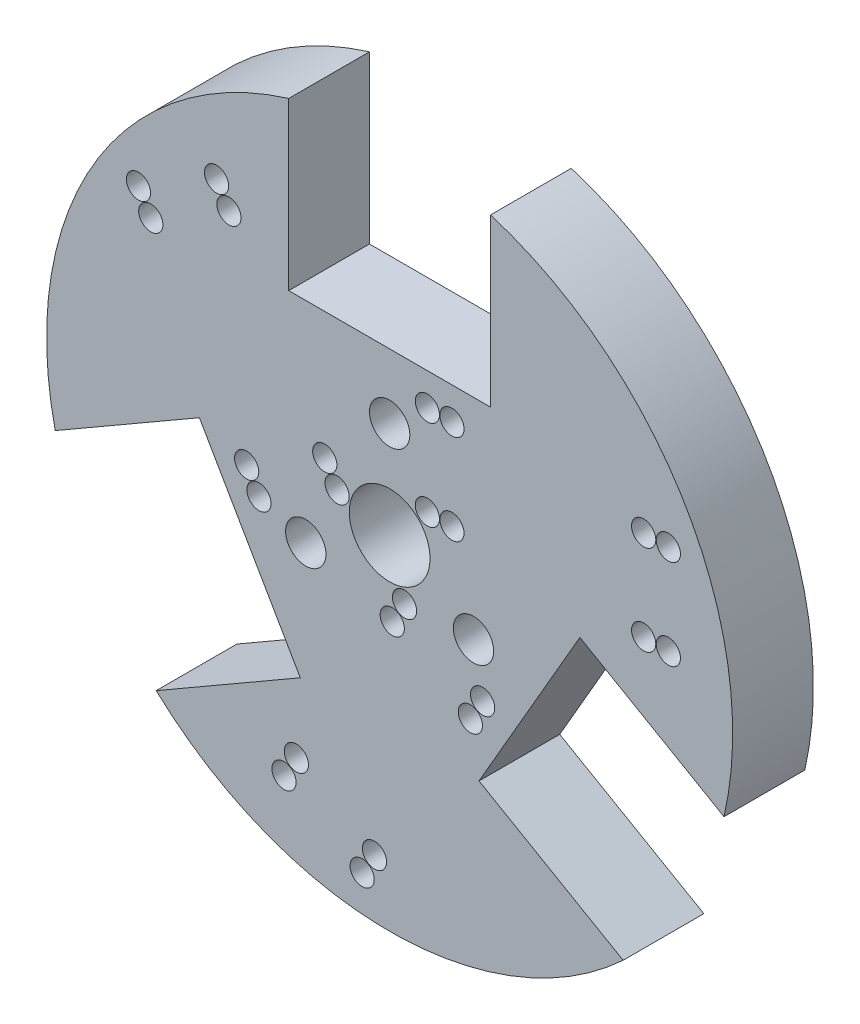
from build123d import *

# Parameters (mm, degrees)
SKETCH4_R      = 42.5
BASE_DEPTH     = 10
SKETCH5_R      = 5
SKETCH5_W      = 25
SKETCH5_H      = 40
TYRE_CUT_DEPTH = 10
SKETCH6_R      = 1.5
SKETCH6_R_2    = 2.5
NUTS_DEPTH     = 10


with BuildPart() as part:
    # Sketch4 → base (new body)
    with BuildSketch(Plane.XY):
        Circle(SKETCH4_R)
    extrude(amount=BASE_DEPTH)

    # Sketch5 → Tyre cut (cut)
    with BuildSketch(Plane.XY):
        Circle(SKETCH5_R)
        with Locations((0, 40)):
            Rectangle(SKETCH5_W, SKETCH5_H)
        Polygon((11.070508076, -20.825317547), (23.570508076, 0.825317547), (58.211524227, -19.174682453), (45.711524227, -40.825317547), align=None)
        Polygon((-23.570508076, 0.825317547), (-11.070508076, -20.825317547), (-45.711524227, -40.825317547), (-58.211524227, -19.174682453), align=None)
    extrude(amount=TYRE_CUT_DEPTH, mode=Mode.SUBTRACT)

    # Sketch6 → NUTs (cut)
    with BuildSketch(Plane.XY):
        with Locations((7.71570735, 16)):
            Circle(SKETCH6_R)
        with Locations((7.71570735, 4.825317547)):
            Circle(SKETCH6_R)
        with Locations(Location((34.527154016, 4.825317547, 0), (0, 0, 180))):
            Circle(SKETCH6_R)
        with Locations(Location((34.527154016, 16, 0), (0, 0, 180))):
            Circle(SKETCH6_R)
        with Locations((9.998552785, -14.681998573)):
            Circle(SKETCH6_R)
        with Locations((0.320993902, -9.094657347)):
            Circle(SKETCH6_R)
        with Locations(Location((-13.084729431, -32.314051272, 0), (0, 0, 180))):
            Circle(SKETCH6_R)
        with Locations(Location((-3.407170547, -37.901392498, 0), (0, 0, 180))):
            Circle(SKETCH6_R)
        with Locations((-17.714260136, -1.318001427)):
            Circle(SKETCH6_R)
        with Locations((-8.036701252, 4.2693398)):
            Circle(SKETCH6_R)
        with Locations(Location((-21.442424585, 27.488733725, 0), (0, 0, 180))):
            Circle(SKETCH6_R)
        with Locations(Location((-31.119983469, 21.901392498, 0), (0, 0, 180))):
            Circle(SKETCH6_R)
        with Locations((0, 12)):
            Circle(SKETCH6_R_2)
        with Locations((10.392304845, -6)):
            Circle(SKETCH6_R_2)
        with Locations((-10.392304845, -6)):
            Circle(SKETCH6_R_2)
        with Locations((31.472579283, 16)):
            Circle(SKETCH6_R)
        with Locations((31.472579283, 4.825317547)):
            Circle(SKETCH6_R)
        with Locations((4.672579283, 16)):
            Circle(SKETCH6_R)
        with Locations((4.672579283, 4.825317547)):
            Circle(SKETCH6_R)
        with Locations((11.520116819, -12.04657236)):
            Circle(SKETCH6_R)
        with Locations((1.842557936, -6.459231134)):
            Circle(SKETCH6_R)
        with Locations((-1.879883181, -35.256053181)):
            Circle(SKETCH6_R)
        with Locations((-11.557442064, -29.668711955)):
            Circle(SKETCH6_R)
        with Locations((-16.192696102, -3.95342764)):
            Circle(SKETCH6_R)
        with Locations((-6.515137219, 1.633913586)):
            Circle(SKETCH6_R)
        with Locations((-29.592696102, 19.256053181)):
            Circle(SKETCH6_R)
        with Locations((-19.915137219, 24.843394408)):
            Circle(SKETCH6_R)
    extrude(amount=NUTS_DEPTH, mode=Mode.SUBTRACT)


solid = part.part
